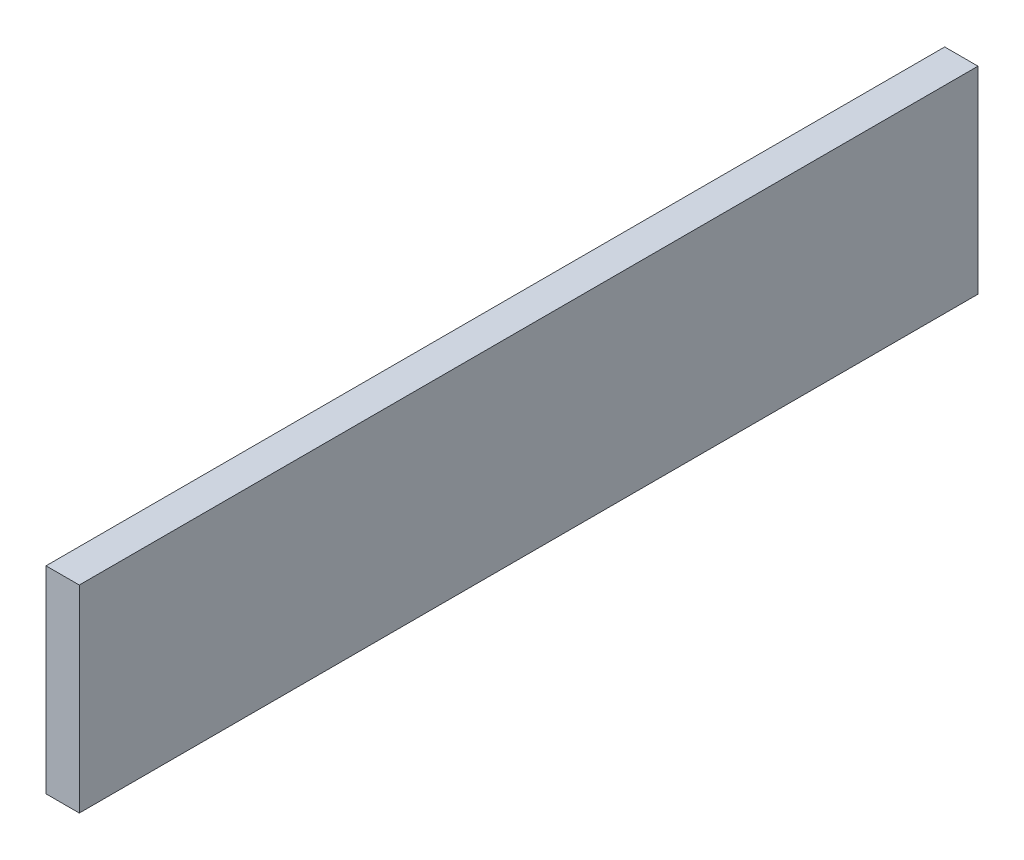
from build123d import *

# Parameters (mm, degrees)
CROQUIS1_W              = 405
CROQUIS1_H              = 89
SALIENTE_EXTRUIR1_DEPTH = 15


with BuildPart() as part:
    # Croquis1 → Saliente-Extruir1 (new body)
    with BuildSketch(Plane(origin=(0, 0, 0), x_dir=(0, 0, -1), z_dir=(1, 0, 0))):
        with Locations((202.5, 44.5)):
            Rectangle(CROQUIS1_W, CROQUIS1_H)
    extrude(amount=SALIENTE_EXTRUIR1_DEPTH)


solid = part.part
